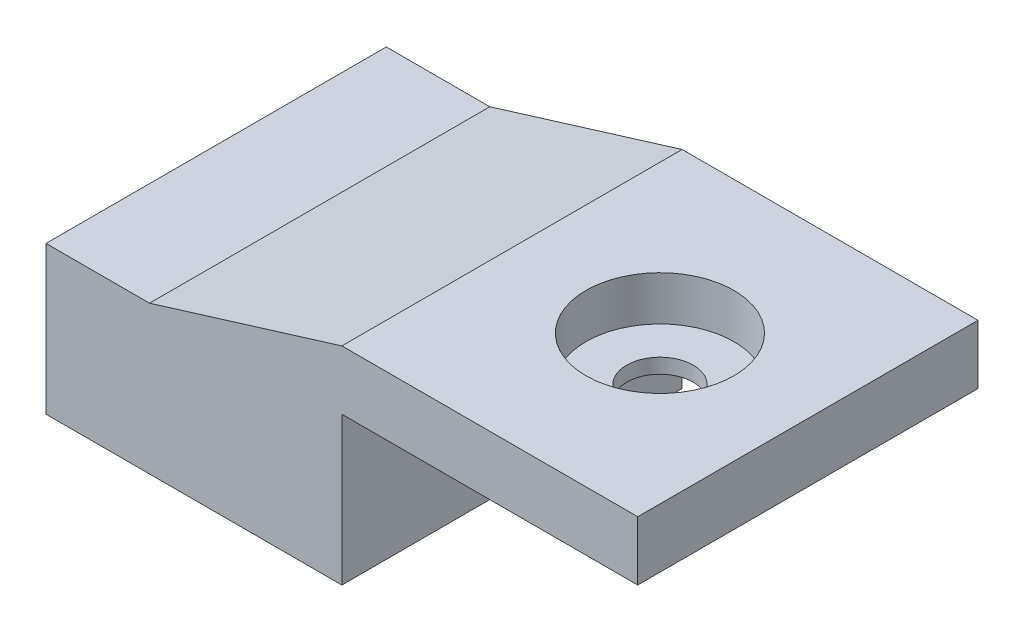
from build123d import *

# Parameters (mm, degrees)
ESTRUSIONE_ESTRUSIONE1_DEPTH                         = 23
FORO_PER_VITE_M4_1_D                                 = 5.6
FORO_PER_VITE_M4_1_DEPTH                             = 10
FORO_PER_VITE_M4_1_TIP                               = 1.682409733
FORO_LAMATO_PER_BULLONE_M5_A_TESTA_ESAGO_D           = 4.5
FORO_LAMATO_PER_BULLONE_M5_A_TESTA_ESAGO_DEPTH       = 10
FORO_LAMATO_PER_BULLONE_M5_A_TESTA_ESAGO_CBORE_D     = 10
FORO_LAMATO_PER_BULLONE_M5_A_TESTA_ESAGO_CBORE_DEPTH = 3
FORO_LAMATO_PER_BULLONE_M5_A_TESTA_ESAGO_TIP         = 1.351936393


with BuildPart() as part:
    # Schizzo1 → Estrusione-Estrusione1 (new body)
    with BuildSketch(Plane.XY):
        Polygon((0, 0), (20, 0), (20, 10), (40, 10), (40, 14), (20, 14), (7, 10), (0, 10), align=None)
    extrude(amount=ESTRUSIONE_ESTRUSIONE1_DEPTH)

    # Foro per Vite M4-1
    with Locations(Plane(origin=(0, 3.886151, 5), x_dir=(0, 0, -1), z_dir=(-1, 0, 0))):
        with Locations((0, 0), (-13, 0)):
            Hole(FORO_PER_VITE_M4_1_D / 2, depth=FORO_PER_VITE_M4_1_DEPTH)
            with Locations((0, 0, -(FORO_PER_VITE_M4_1_DEPTH + FORO_PER_VITE_M4_1_TIP / 2))):  # 118° drill point
                Cone(0, FORO_PER_VITE_M4_1_D / 2, FORO_PER_VITE_M4_1_TIP, mode=Mode.SUBTRACT)

    # Foro lamato per Bullone M5 a testa esagonale-1
    with Locations(Plane(origin=(0, 14, 0), x_dir=(1, 0, 0), z_dir=(0, 1, 0))):
        with Locations((30, -11.5)):
            CounterBoreHole(FORO_LAMATO_PER_BULLONE_M5_A_TESTA_ESAGO_D / 2, FORO_LAMATO_PER_BULLONE_M5_A_TESTA_ESAGO_CBORE_D / 2, FORO_LAMATO_PER_BULLONE_M5_A_TESTA_ESAGO_CBORE_DEPTH, depth=FORO_LAMATO_PER_BULLONE_M5_A_TESTA_ESAGO_DEPTH)
            with Locations((0, 0, -(FORO_LAMATO_PER_BULLONE_M5_A_TESTA_ESAGO_DEPTH + FORO_LAMATO_PER_BULLONE_M5_A_TESTA_ESAGO_TIP / 2))):  # 118° drill point
                Cone(0, FORO_LAMATO_PER_BULLONE_M5_A_TESTA_ESAGO_D / 2, FORO_LAMATO_PER_BULLONE_M5_A_TESTA_ESAGO_TIP, mode=Mode.SUBTRACT)


solid = part.part
